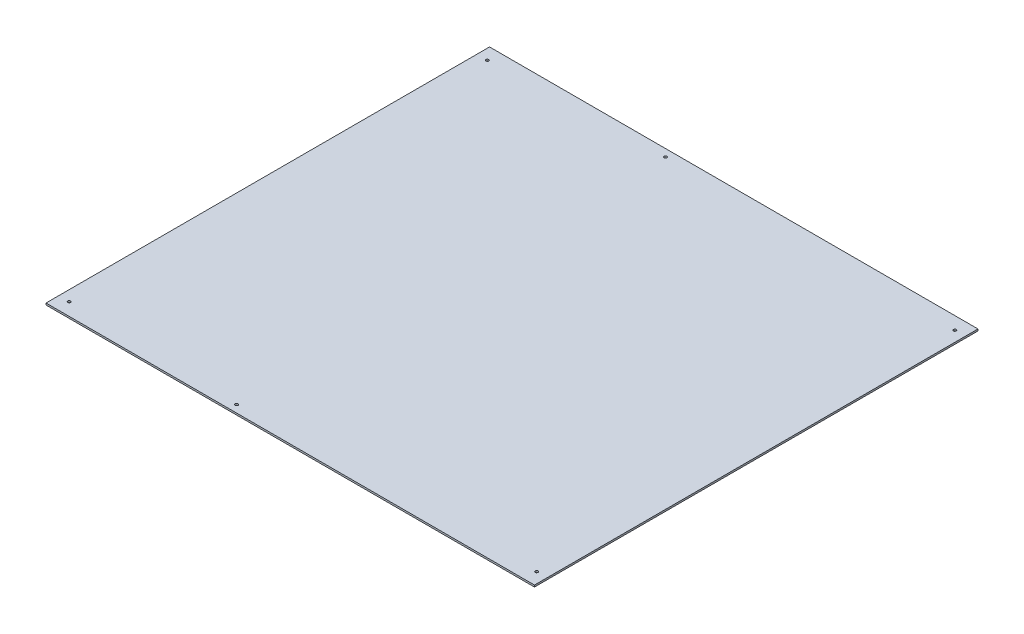
from build123d import *

# Parameters (mm, degrees)
CROQUIS1_W              = 550.5
CROQUIS1_H              = 500
SALIENTE_EXTRUIR1_DEPTH = 2
CROQUIS2_R              = 1.55
CORTAR_EXTRUIR1_DEPTH   = 2
CROQUIS3_W              = 550.5
CROQUIS3_H              = 500
CROQUIS3_W_2            = 549
CROQUIS3_H_2            = 498.5
CORTAR_EXTRUIR2_DEPTH   = 2
CROQUIS4_R              = 1.6
CORTAR_EXTRUIR3_DEPTH   = 2


with BuildPart() as part:
    # Croquis1 → Saliente-Extruir1 (new body)
    with BuildSketch(Plane(origin=(0, 0, 0), x_dir=(1, 0, 0), z_dir=(0, 1, 0))):
        with Locations((275.25, 250)):
            Rectangle(CROQUIS1_W, CROQUIS1_H)
    extrude(amount=SALIENTE_EXTRUIR1_DEPTH)

    # Croquis2 → Cortar-Extruir1 (cut)
    with BuildSketch(Plane(origin=(0, 2, 0), x_dir=(1, 0, 0), z_dir=(0, 1, 0))):
        with Locations(Location((12.5, 485, 0), (0, 0, 270))):
            Circle(CROQUIS2_R)
        with Locations(Location((538, 485, 0), (0, 0, 90))):
            Circle(CROQUIS2_R)
        with Locations(Location((538, 15, 0), (0, 0, 270))):
            Circle(CROQUIS2_R)
        with Locations(Location((12.5, 15, 0), (0, 0, 90))):
            Circle(CROQUIS2_R)
    extrude(amount=-CORTAR_EXTRUIR1_DEPTH, mode=Mode.SUBTRACT)

    # Croquis3 → Cortar-Extruir2 (cut)
    with BuildSketch(Plane(origin=(0, 2, 0), x_dir=(1, 0, 0), z_dir=(0, 1, 0))):
        with Locations((275.25, 250)):
            Rectangle(CROQUIS3_W, CROQUIS3_H)
        with Locations((275.25, 250)):
            Rectangle(CROQUIS3_W_2, CROQUIS3_H_2, mode=Mode.SUBTRACT)
    extrude(amount=-CORTAR_EXTRUIR2_DEPTH, mode=Mode.SUBTRACT)

    # Croquis4 → Cortar-Extruir3 (cut)
    with BuildSketch(Plane(origin=(0, 2, 0), x_dir=(1, 0, 0), z_dir=(0, 1, 0))):
        with Locations(Location((206.75, 491, 0), (0, 0, 270))):
            Circle(CROQUIS4_R)
        with Locations(Location((206.75, 9, 0), (0, 0, 270))):
            Circle(CROQUIS4_R)
    extrude(amount=-CORTAR_EXTRUIR3_DEPTH, mode=Mode.SUBTRACT)


solid = part.part
